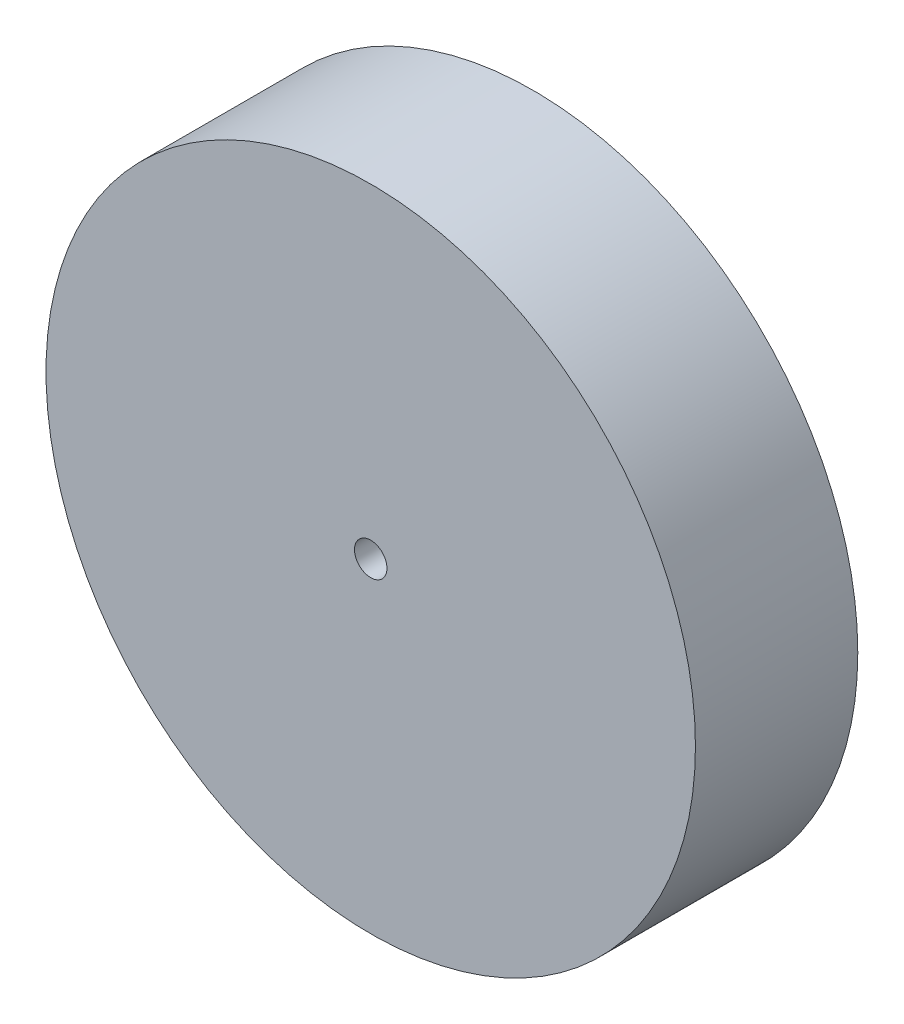
from build123d import *

# Parameters (mm, degrees)
SKETCH1_R           = 10
BOSS_EXTRUDE1_DEPTH = 5
SKETCH2_R           = 0.5
CUT_EXTRUDE1_DEPTH  = 5
SKETCH3_R           = 1.7
CUT_EXTRUDE2_DEPTH  = 0.2


with BuildPart() as part:
    # Sketch1 → Boss-Extrude1 (new body)
    with BuildSketch(Plane.XY):
        Circle(SKETCH1_R)
    extrude(amount=BOSS_EXTRUDE1_DEPTH)

    # Sketch2 → Cut-Extrude1 (cut)
    with BuildSketch(Plane.XY.offset(5)):
        Circle(SKETCH2_R)
    extrude(amount=-CUT_EXTRUDE1_DEPTH, mode=Mode.SUBTRACT)

    # Sketch3 → Cut-Extrude2 (cut)
    with BuildSketch(Plane(origin=(0, 0, 0), x_dir=(-1, 0, 0), z_dir=(0, 0, -1))):
        Circle(SKETCH3_R)
    extrude(amount=-CUT_EXTRUDE2_DEPTH, mode=Mode.SUBTRACT)


solid = part.part
